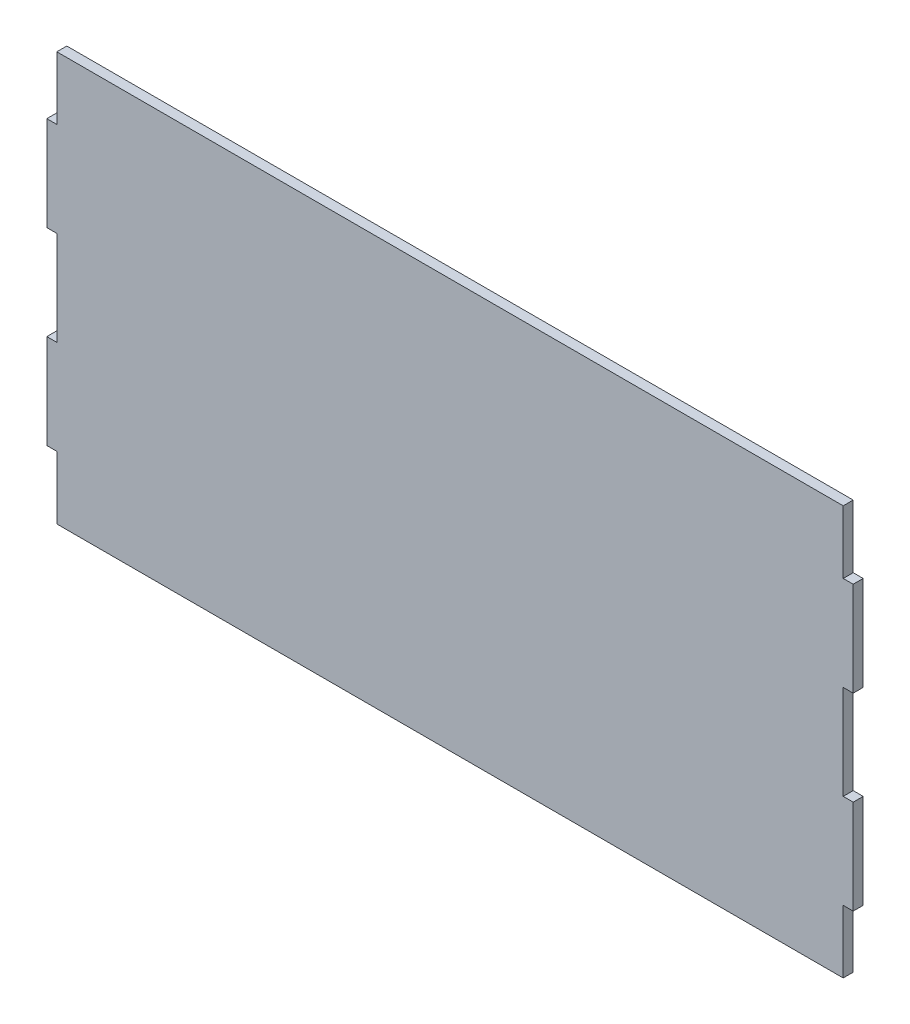
from build123d import *

# Parameters (mm, degrees)
SKETCH1_W           = 250
SKETCH1_H           = 130
BOSS_EXTRUDE1_DEPTH = 3.175
SKETCH2_W           = 3.175
SKETCH2_H           = 30
BOSS_EXTRUDE2_DEPTH = 3.175


with BuildPart() as part:
    # Sketch1 → Boss-Extrude1 (new body)
    with BuildSketch(Plane.XY):
        with Locations((125, -65)):
            Rectangle(SKETCH1_W, SKETCH1_H)
    extrude(amount=BOSS_EXTRUDE1_DEPTH)

    # Sketch2 → Boss-Extrude2 (add)
    with BuildSketch(Plane.XY.offset(3.175)):
        with Locations((-1.5875, -35)):
            Rectangle(SKETCH2_W, SKETCH2_H)
        with Locations((251.5875, -35)):
            Rectangle(SKETCH2_W, SKETCH2_H)
        with Locations((-1.5875, -95)):
            Rectangle(SKETCH2_W, SKETCH2_H)
        with Locations((251.5875, -95)):
            Rectangle(SKETCH2_W, SKETCH2_H)
    extrude(amount=-BOSS_EXTRUDE2_DEPTH)


solid = part.part
